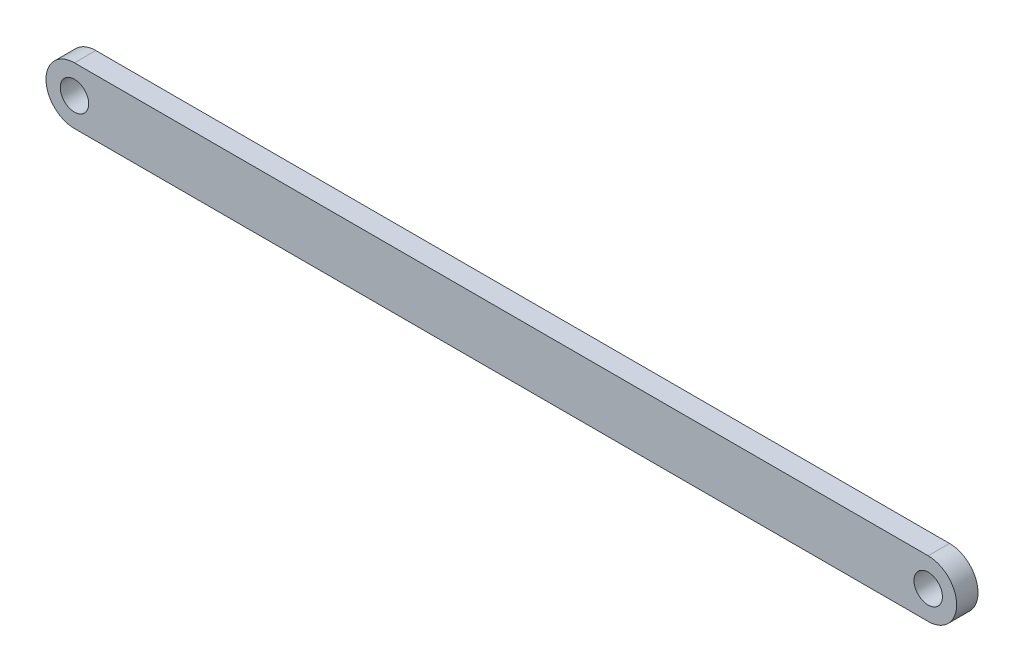
from build123d import *

# Parameters (mm, degrees)
SKETCH_1_R      = 1
EXTRUDE_1_DEPTH = 1.5


with BuildPart() as part:
    # 草图1 → 凸台-拉伸1 (new body)
    with BuildSketch(Plane.XY):
        with BuildLine():
            Line((0, 2), (60, 2))
            ThreePointArc((60, 2), (62, 0), (60, -2))
            Line((60, -2), (0, -2))
            ThreePointArc((0, -2), (-2, 0), (0, 2))
        make_face()
        with Locations((60, 0)):
            Circle(SKETCH_1_R, mode=Mode.SUBTRACT)
        Circle(SKETCH_1_R, mode=Mode.SUBTRACT)
    extrude(amount=EXTRUDE_1_DEPTH)


solid = part.part
